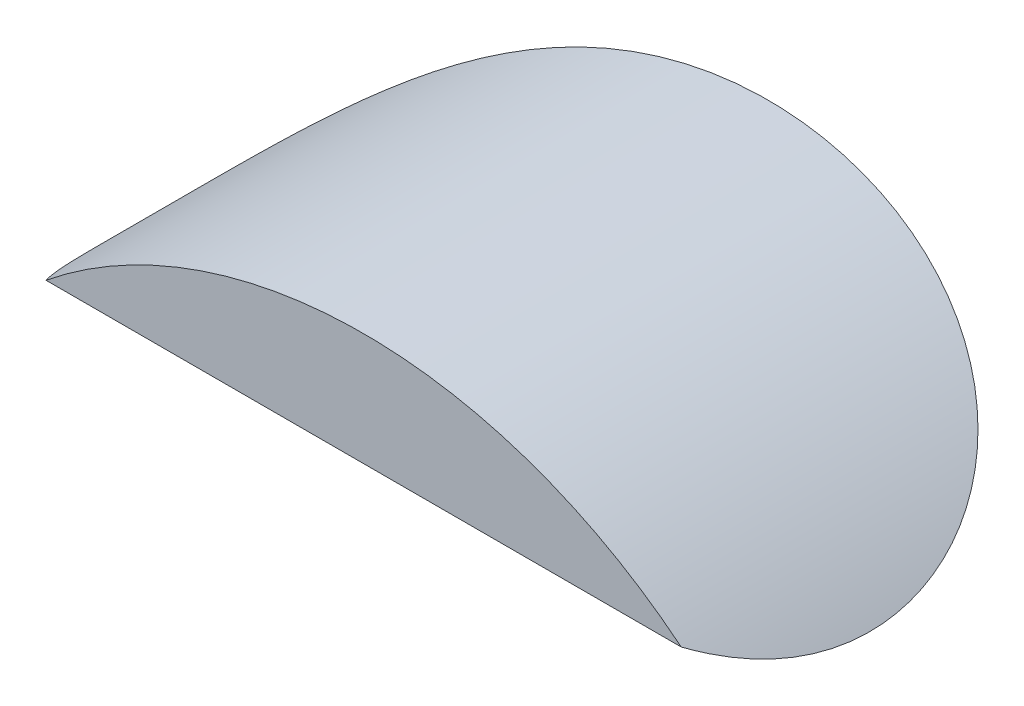
from build123d import *

# Parameters (mm, degrees)
SKETCH1_R           = 11.75
BOSS_EXTRUDE1_DEPTH = 60
CUT_EXTRUDE1_DEPTH  = 63.258533552
CUT_EXTRUDE2_DEPTH  = 64.608686514


with BuildPart() as part:
    # Sketch1 → Boss-Extrude1 (new body)
    with BuildSketch(Plane(origin=(0, 0, 0), x_dir=(0, 0, -1), z_dir=(1, 0, 0))):
        Circle(SKETCH1_R)
    extrude(amount=BOSS_EXTRUDE1_DEPTH)

    # Sketch2 → Cut-Extrude1 (cut, through all)
    with BuildSketch(Plane.ZY):
        with BuildLine():
            Line((5.8, 10.218732798), (5.8, -10.218732798))
            ThreePointArc((5.8, -10.218732798), (11.75, 0), (5.8, 10.218732798))
        make_face()
    extrude(amount=-CUT_EXTRUDE1_DEPTH, mode=Mode.SUBTRACT)

    # Sketch3 → Cut-Extrude2 (cut, through all)
    with BuildSketch(Plane.XY.offset(5.8)):
        with BuildLine():
            Line((0, 11.75), (60, 11.75))
            Line((60, 11.75), (60, -11.75))
            Line((60, -11.75), (44.282856857, -11.75))
            ThreePointArc((44.282856857, -11.75), (30, -5.75), (15.717143143, -11.75))
            Line((15.717143143, -11.75), (0, -11.75))
            Line((0, -11.75), (0, 11.75))
        make_face()
    extrude(amount=-CUT_EXTRUDE2_DEPTH, mode=Mode.SUBTRACT)


solid = part.part
